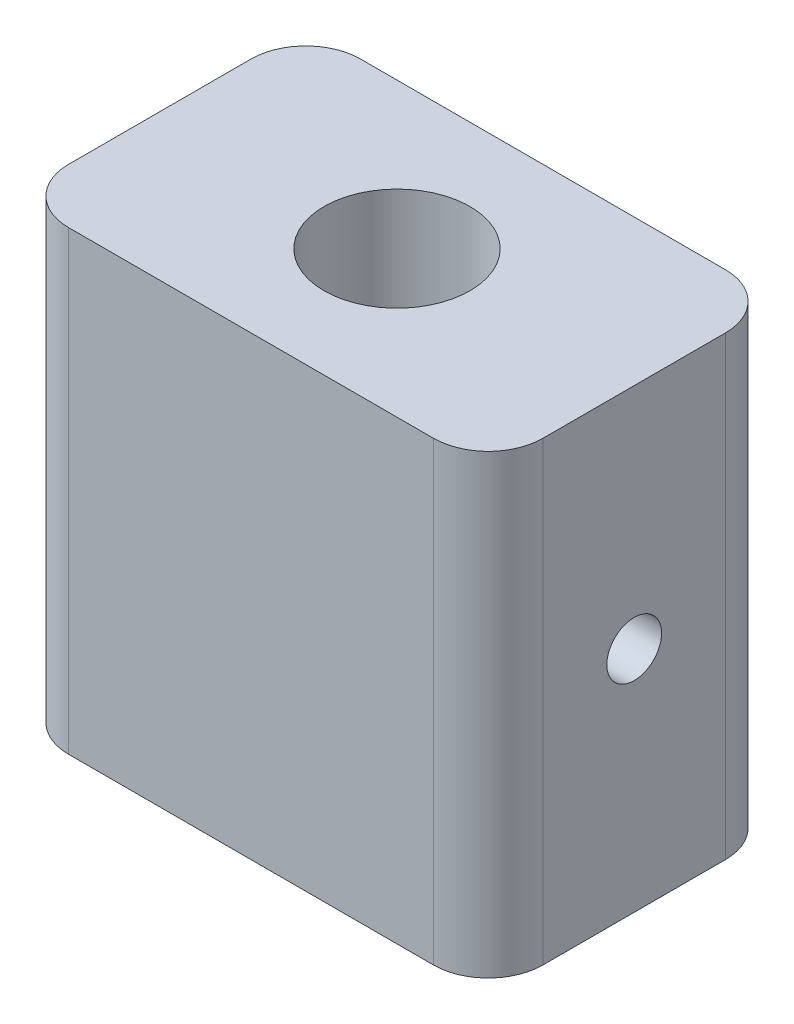
from build123d import *

# Parameters (mm, degrees)
SKETCH1_R           = 4
BOSS_EXTRUDE1_DEPTH = 25
SKETCH2_R           = 1.5
CUT_EXTRUDE1_DEPTH  = 46


with BuildPart() as part:
    # Sketch1 → Boss-Extrude1 (new body)
    with BuildSketch(Plane(origin=(0, 0, 0), x_dir=(1, 0, 0), z_dir=(0, 1, 0))):
        with BuildLine():
            Line((10, -8), (-10, -8))
            ThreePointArc((-10, -8), (-12.121320344, -7.121320344), (-13, -5))
            Line((-13, -5), (-13, 5))
            ThreePointArc((-13, 5), (-12.121320344, 7.121320344), (-10, 8))
            Line((-10, 8), (10, 8))
            ThreePointArc((10, 8), (12.121320344, 7.121320344), (13, 5))
            Line((13, 5), (13, -5))
            ThreePointArc((13, -5), (12.121320344, -7.121320344), (10, -8))
        make_face()
        with Locations(Location((0, 0, 0), (0, 0, 270))):
            Circle(SKETCH1_R, mode=Mode.SUBTRACT)
    extrude(amount=BOSS_EXTRUDE1_DEPTH)

    # Sketch2 → Cut-Extrude1 (cut)
    with BuildSketch(Plane(origin=(13, 0, 0), x_dir=(0, 0, -1), z_dir=(1, 0, 0))):
        with Locations((0, 12.5)):
            Circle(SKETCH2_R)
    extrude(amount=-CUT_EXTRUDE1_DEPTH, mode=Mode.SUBTRACT)


solid = part.part
